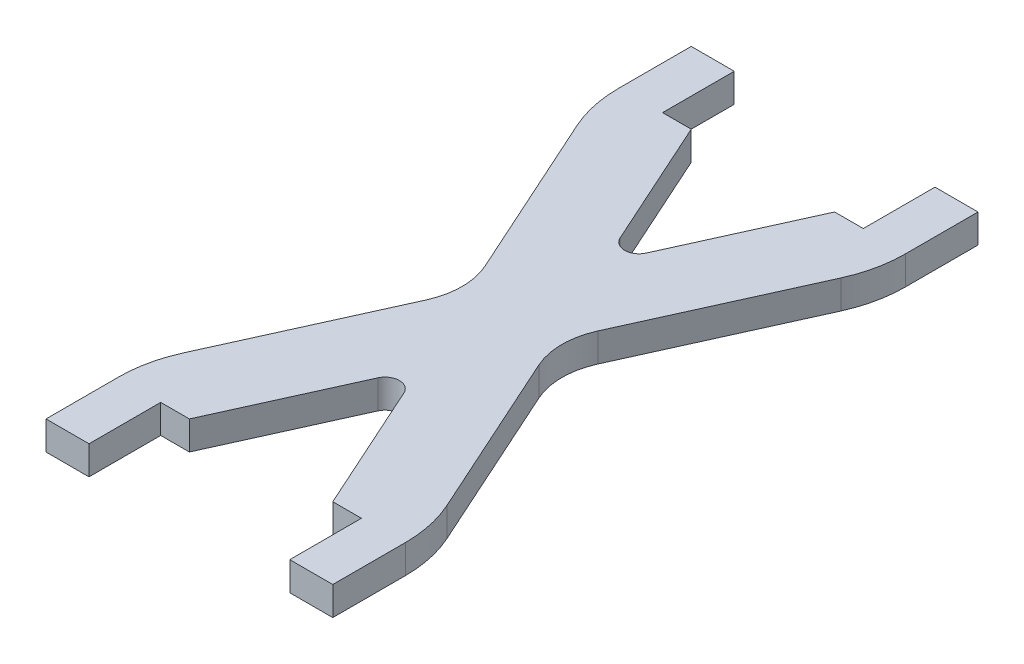
from build123d import *

# Parameters (mm, degrees)
BOSS_EXTRUDE1_DEPTH = 2
FILLET1_R           = 1
FILLET2_R           = 5
FILLET3_R           = 9


with BuildPart() as part:
    # Sketch1 → Boss-Extrude1 (new body)
    with BuildSketch(Plane(origin=(0, 0, 0), x_dir=(1, 0, 0), z_dir=(0, 1, 0))):
        Polygon((3, 0), (5, 0), (10, 11.071428571), (15, 0), (17, 0), (17, -5), (20, -5), (20, 0), (20, 2), (13, 17.5), (20, 33), (20, 35), (20, 40), (17, 40), (17, 35), (15, 35), (10, 23.928571429), (5, 35), (3, 35), (3, 40), (0, 40), (0, 35), (0, 33), (7, 17.5), (0, 2), (0, 0), (0, -5), (3, -5), align=None)
    extrude(amount=BOSS_EXTRUDE1_DEPTH)

    # Fillet1
    fillet1_edges = [part.edges().sort_by_distance(p)[0] for p in [
        (10, 1, -23.928571429),
        (10, 1, -11.071428571),
    ]]
    fillet(fillet1_edges, radius=FILLET1_R)

    # Fillet2
    fillet2_edges = [part.edges().sort_by_distance(p)[0] for p in [
        (7, 1, -17.5),
        (13, 1, -17.5),
    ]]
    fillet(fillet2_edges, radius=FILLET2_R)

    # Fillet3
    fillet3_edges = [part.edges().sort_by_distance(p)[0] for p in [
        (0, 1, -2),
        (0, 1, -33),
        (20, 1, -33),
        (20, 1, -2),
    ]]
    fillet(fillet3_edges, radius=FILLET3_R)


solid = part.part
